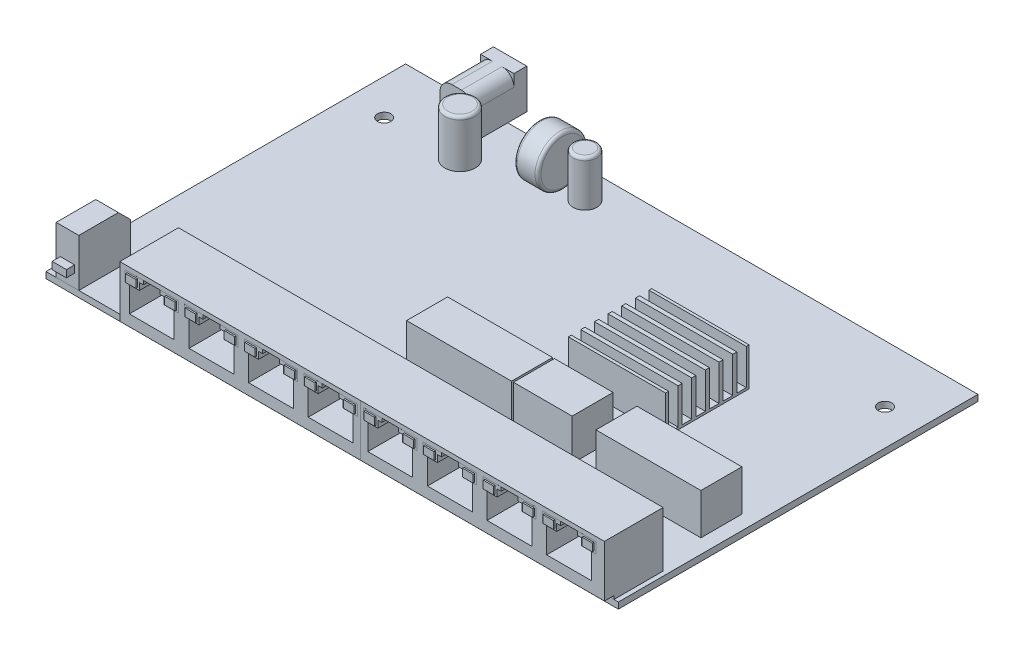
from build123d import *

# Parameters (mm, degrees)
SKETCH1_W                                = 152.4
SKETCH1_H                                = 95.758
EXTRUDE1_DEPTH                           = 1.651
SKETCH2_W                                = 6.0198
SKETCH2_H                                = 13.716
EXTRUDE2_DEPTH                           = 12.7
CHAMFER1_SIZE                            = 3.175
SKETCH3_W                                = 3.81
SKETCH3_H                                = 1.905
EXTRUDE3_DEPTH                           = 2.1844
SKETCH4_W                                = 129.032
SKETCH4_H                                = 15.621
EXTRUDE4_DEPTH                           = 14.665
CUT_EXTRUDE1_DEPTH                       = 11.43
SKETCH8_W                                = 2.794
SKETCH8_H                                = 2.032
EXTRUDE5_DEPTH                           = 0.396875
SKETCH8_3_W                              = 2.794
SKETCH8_3_H                              = 2.032
EXTRUDE13_DEPTH                          = 0.00127
LPATTERN2_COUNT                          = 8
LPATTERN2_PITCH                          = 15.875
SKETCH9_W                                = 27.94
SKETCH9_H                                = 10.922
EXTRUDE6_DEPTH                           = 10.922
SKETCH9_W_2                              = 15.621
EXTRUDE6_2_DEPTH                         = 10.922
EXTRUDE6_3_DEPTH                         = 10.922
SKETCH10_W                               = 25.908
SKETCH10_H                               = 22.225
EXTRUDE7_DEPTH                           = 10.16
SKETCH11_W                               = 2.54
SKETCH11_H                               = 9.525
EXTRUDE8_DEPTH                           = 25.908
LPATTERN1_COUNT                          = 6
LPATTERN1_PITCH                          = 3.6322
SKETCH12_W                               = 8.89
SKETCH12_H                               = 14.224
EXTRUDE9_DEPTH                           = 10.541
EXTRUDE10_DEPTH                          = 10.795
SKETCH15_R                               = 3.175
EXTRUDE11_DEPTH                          = 8.89
SKETCH16_R                               = 0.79375
EXTRUDE12_DEPTH                          = 7.62
FILLET1_R                                = 0.79375
SKETCH17_W                               = 1.786001
SKETCH17_H                               = 1.651
F_9_64_0_14063_DIAMETER_HOLE1_AT_2_COUNT = 2
F_9_64_0_14063_DIAMETER_HOLE1_AT_2_PITCH = 133.35
SKETCH19_R                               = 4.064
EXTRUDE14_DEPTH                          = 12.7
FILLET2_R                                = 0.79375
SKETCH20_R                               = 3.175
EXTRUDE15_DEPTH                          = 12.192
FILLET3_R                                = 0.79375
SKETCH21_R                               = 6.6675
EXTRUDE16_DEPTH                          = 3.175
FILLET4_R                                = 0.79375
SKETCH22_W                               = 129.032
SKETCH22_H                               = 0.9
CUT_EXTRUDE2_DEPTH                       = 2.54
SKETCH23_W                               = 0.1
SKETCH23_H                               = 0.99375
CUT_EXTRUDE3_DEPTH                       = 183.298245212


with BuildPart() as part:
    # Sketch1 → Extrude1 (new body)
    with BuildSketch(Plane(origin=(0, 0, 0), x_dir=(1, 0, 0), z_dir=(0, 1, 0))):
        with Locations((76.2, -47.879)):
            Rectangle(SKETCH1_W, SKETCH1_H)
    extrude(amount=EXTRUDE1_DEPTH)

    # Sketch17 → 9/64 (0.14063) Diameter Hole1 (revolve, cut)
    with BuildSketch(Plane(origin=(9.525, 1.651, 15.24), x_dir=(0, 0, 1), z_dir=(1, 0, 0))):
        with Locations((0.8930005, 0.8255)):
            Rectangle(SKETCH17_W, SKETCH17_H)
    f_9_64_0_14063_diameter_hole1 = revolve(axis=Axis((9.525, 8.001, 15.24), (0, -1, 0)), mode=Mode.SUBTRACT)

    # 9/64 (0.14063) Diameter Hole1 at 2: 9/64 (0.14063) Diameter Hole1 ×2
    with Locations(*[(i * F_9_64_0_14063_DIAMETER_HOLE1_AT_2_PITCH, 0, 0) for i in range(1, F_9_64_0_14063_DIAMETER_HOLE1_AT_2_COUNT)]):
        add(f_9_64_0_14063_diameter_hole1, mode=Mode.SUBTRACT)


with BuildPart() as body_2:
    # Sketch2 → Extrude2 (new body)
    with BuildSketch(Plane(origin=(0, 1.651, 0), x_dir=(1, 0, 0), z_dir=(0, 1, 0))):
        with Locations((5.7219, -88.9)):
            Rectangle(SKETCH2_W, SKETCH2_H)
    extrude(amount=EXTRUDE2_DEPTH)

    # Chamfer1
    chamfer1_edges = [body_2.edges().sort_by_distance(p)[0] for p in [
        (5.7219, 14.351, 82.042),
    ]]
    chamfer(chamfer1_edges, length=CHAMFER1_SIZE)

    # Sketch3 → Extrude3 (add)
    with BuildSketch(Plane.XY.offset(95.758)):
        with Locations((5.7219, 6.0535)):
            Rectangle(SKETCH3_W, SKETCH3_H)
    extrude(amount=EXTRUDE3_DEPTH)


with BuildPart() as body_3:
    # Sketch4 → Extrude4 (new body)
    with BuildSketch(Plane(origin=(0, 1.651, 0), x_dir=(1, 0, 0), z_dir=(0, 1, 0))):
        with Locations((86.713, -90.4875)):
            Rectangle(SKETCH4_W, SKETCH4_H)
    extrude(amount=EXTRUDE4_DEPTH)

    # Sketch6 → Cut-Extrude1 (cut)
    with BuildSketch(Plane.XY.offset(98.298)):
        Polygon((28.4708, 14.1062), (28.4708, 15.1222), (32.9412, 15.1222), (32.9412, 14.1062), (34.008, 14.1062), (34.008, 12.252), (36.675, 12.252), (36.675, 5.521), (24.737, 5.521), (24.737, 12.252), (27.404, 12.252), (27.404, 14.1062), align=None)
    cut_extrude1 = extrude(amount=-CUT_EXTRUDE1_DEPTH, mode=Mode.SUBTRACT)

    # Sketch8 → Extrude5 (add)
    with BuildSketch(Plane.XY.offset(98.298)):
        with Locations((25.499, 13.6871)):
            Rectangle(SKETCH8_W, SKETCH8_H)
        with Locations((35.913, 13.6871)):
            Rectangle(SKETCH8_W, SKETCH8_H)
    extrude5 = extrude(amount=EXTRUDE5_DEPTH)

    # Sketch8<3> → Extrude13 (add)
    # profile 1 of 2: a face of its own
    with BuildSketch(Plane.XY.offset(98.298)):
        Polygon((27.404, 12.252), (23.594, 12.252), (23.594, 15.1222), (27.404, 15.1222), (28.4708, 15.1222), (28.4708, 14.1062), (27.404, 14.1062), align=None)
        with Locations((25.499, 13.6871)):
            Rectangle(SKETCH8_3_W, SKETCH8_3_H, mode=Mode.SUBTRACT)
    # profile 2 of 2: a face of its own
    with BuildSketch(Plane.XY.offset(98.298)):
        Polygon((34.008, 12.252), (37.818, 12.252), (37.818, 15.1222), (34.008, 15.1222), (32.9412, 15.1222), (32.9412, 14.1062), (34.008, 14.1062), align=None)
        with Locations((35.913, 13.6871)):
            Rectangle(SKETCH8_3_W, SKETCH8_3_H, mode=Mode.SUBTRACT)
    extrude13 = extrude(amount=EXTRUDE13_DEPTH)

    # LPattern2: Cut-Extrude1, Extrude5, Extrude13 ×8
    with Locations(*[(i * LPATTERN2_PITCH, 0, 0) for i in range(1, LPATTERN2_COUNT)]):
        add(cut_extrude1, mode=Mode.SUBTRACT)
        add(extrude5)
        add(extrude13)

    # Sketch22 → Cut-Extrude2 (cut)
    with BuildSketch(Plane.XY.offset(98.298)):
        with Locations((86.713, 2.101)):
            Rectangle(SKETCH22_W, SKETCH22_H)
    extrude(amount=-CUT_EXTRUDE2_DEPTH, mode=Mode.SUBTRACT)

    # Sketch23 → Cut-Extrude3 (cut, through all)
    with BuildSketch(Plane(origin=(0, 16.316, 0), x_dir=(1, 0, 0), z_dir=(0, 1, 0))):
        with Locations((86.2685, -98.694875)):
            Rectangle(SKETCH23_W, SKETCH23_H)
    extrude(amount=-CUT_EXTRUDE3_DEPTH, mode=Mode.SUBTRACT)


with BuildPart() as body_4:
    # Sketch9 → Extrude6 (new body)
    with BuildSketch(Plane(origin=(0, 1.651, 0), x_dir=(1, 0, 0), z_dir=(0, 1, 0))):
        with Locations((84.201, -64.516)):
            Rectangle(SKETCH9_W, SKETCH9_H)
    extrude(amount=EXTRUDE6_DEPTH)


with BuildPart() as body_5:
    # Sketch9 → Extrude6 2 (new body)
    with BuildSketch(Plane(origin=(0, 1.651, 0), x_dir=(1, 0, 0), z_dir=(0, 1, 0))):
        with Locations((106.4895, -64.516)):
            Rectangle(SKETCH9_W_2, SKETCH9_H)
    extrude(amount=EXTRUDE6_2_DEPTH)


with BuildPart() as body_6:
    # Sketch9 → Extrude6 3 (new body)
    with BuildSketch(Plane(origin=(0, 1.651, 0), x_dir=(1, 0, 0), z_dir=(0, 1, 0))):
        with Locations((134.62, -64.516)):
            Rectangle(SKETCH9_W, SKETCH9_H)
    extrude(amount=EXTRUDE6_3_DEPTH)


with BuildPart() as body_7:
    # Sketch10 → Extrude7 (new body)
    with BuildSketch(Plane(origin=(0, 1.651, 0), x_dir=(1, 0, 0), z_dir=(0, 1, 0))):
        with Locations((107.696, -40.3225)):
            Rectangle(SKETCH10_W, SKETCH10_H)
    extrude(amount=EXTRUDE7_DEPTH)

    # Sketch11 → Extrude8 (cut)
    with BuildSketch(Plane(origin=(120.65, 0, 0), x_dir=(0, 0, -1), z_dir=(1, 0, 0))):
        with Locations((-49.37125, 7.0485)):
            Rectangle(SKETCH11_W, SKETCH11_H)
    extrude8 = extrude(amount=-EXTRUDE8_DEPTH, mode=Mode.SUBTRACT)

    # LPattern1: Extrude8 ×6
    with Locations(*[(0, 0, -i * LPATTERN1_PITCH) for i in range(1, LPATTERN1_COUNT)]):
        add(extrude8, mode=Mode.SUBTRACT)


with BuildPart() as body_8:
    # Sketch12 → Extrude9 (new body)
    with BuildSketch(Plane(origin=(0, 1.651, 0), x_dir=(1, 0, 0), z_dir=(0, 1, 0))):
        with Locations((22.733, -2.032)):
            Rectangle(SKETCH12_W, SKETCH12_H)
    extrude(amount=EXTRUDE9_DEPTH)

    # Sketch14 → Extrude10 (cut)
    with BuildSketch(Plane.XY.offset(9.144)):
        with BuildLine():
            Line((21.463, 12.192), (18.288, 12.192))
            Line((18.288, 12.192), (18.288, 9.017))
            ThreePointArc((18.288, 9.017), (19.21793597, 11.26206403), (21.463, 12.192))
        make_face()
        with BuildLine():
            Line((27.178, 9.017), (27.178, 12.192))
            Line((27.178, 12.192), (24.003, 12.192))
            ThreePointArc((24.003, 12.192), (26.24806403, 11.26206403), (27.178, 9.017))
        make_face()
    extrude(amount=-EXTRUDE10_DEPTH, mode=Mode.SUBTRACT)

    # Sketch15 → Extrude11 (cut)
    with BuildSketch(Plane(origin=(0, 0, -5.08), x_dir=(-1, 0, 0), z_dir=(0, 0, -1))):
        with Locations((-22.733, 8.001)):
            Circle(SKETCH15_R)
    extrude(amount=-EXTRUDE11_DEPTH, mode=Mode.SUBTRACT)

    # Sketch16 → Extrude12 (add)
    with BuildSketch(Plane(origin=(0, 0, 3.81), x_dir=(-1, 0, 0), z_dir=(0, 0, -1))):
        with Locations(Location((-22.733, 8.001, 0), (0, 0, 180))):
            Circle(SKETCH16_R)
    extrude(amount=EXTRUDE12_DEPTH)

    # Fillet1
    fillet1_edges = [body_8.edges().sort_by_distance(p)[0] for p in [
        (21.93925, 8.001, -3.81),
    ]]
    fillet(fillet1_edges, radius=FILLET1_R)


with BuildPart() as body_9:
    # Sketch19 → Extrude14 (new body)
    with BuildSketch(Plane(origin=(0, 1.651, 0), x_dir=(1, 0, 0), z_dir=(0, 1, 0))):
        with Locations(Location((29.21, -14.732, 0), (0, 0, 270))):
            Circle(SKETCH19_R)
    extrude(amount=EXTRUDE14_DEPTH)

    # Fillet2
    fillet2_edges = [body_9.edges().sort_by_distance(p)[0] for p in [
        (29.21, 14.351, 10.668),
    ]]
    fillet(fillet2_edges, radius=FILLET2_R)


with BuildPart() as body_10:
    # Sketch20 → Extrude15 (new body)
    with BuildSketch(Plane(origin=(0, 1.651, 0), x_dir=(1, 0, 0), z_dir=(0, 1, 0))):
        with Locations(Location((55.372, -7.62, 0), (0, 0, 90))):
            Circle(SKETCH20_R)
    extrude(amount=EXTRUDE15_DEPTH)

    # Fillet3
    fillet3_edges = [body_10.edges().sort_by_distance(p)[0] for p in [
        (55.372, 13.843, 10.795),
    ]]
    fillet(fillet3_edges, radius=FILLET3_R)


with BuildPart() as body_11:
    # Sketch21 → Extrude16 (new, symmetric)
    with BuildSketch(Plane.ZY.offset(-46.99)):
        with Locations((8.255, 8.3185)):
            Circle(SKETCH21_R)
    extrude(amount=EXTRUDE16_DEPTH, both=True)

    # Fillet4
    fillet4_edges = [body_11.edges().sort_by_distance(p)[0] for p in [
        (50.165, 8.3185, 1.5875),
        (43.815, 8.3185, 1.5875),
    ]]
    fillet(fillet4_edges, radius=FILLET4_R)


solid = Compound([part.part, body_2.part, body_3.part, body_4.part, body_5.part, body_6.part, body_7.part, body_8.part, body_9.part, body_10.part, body_11.part])
